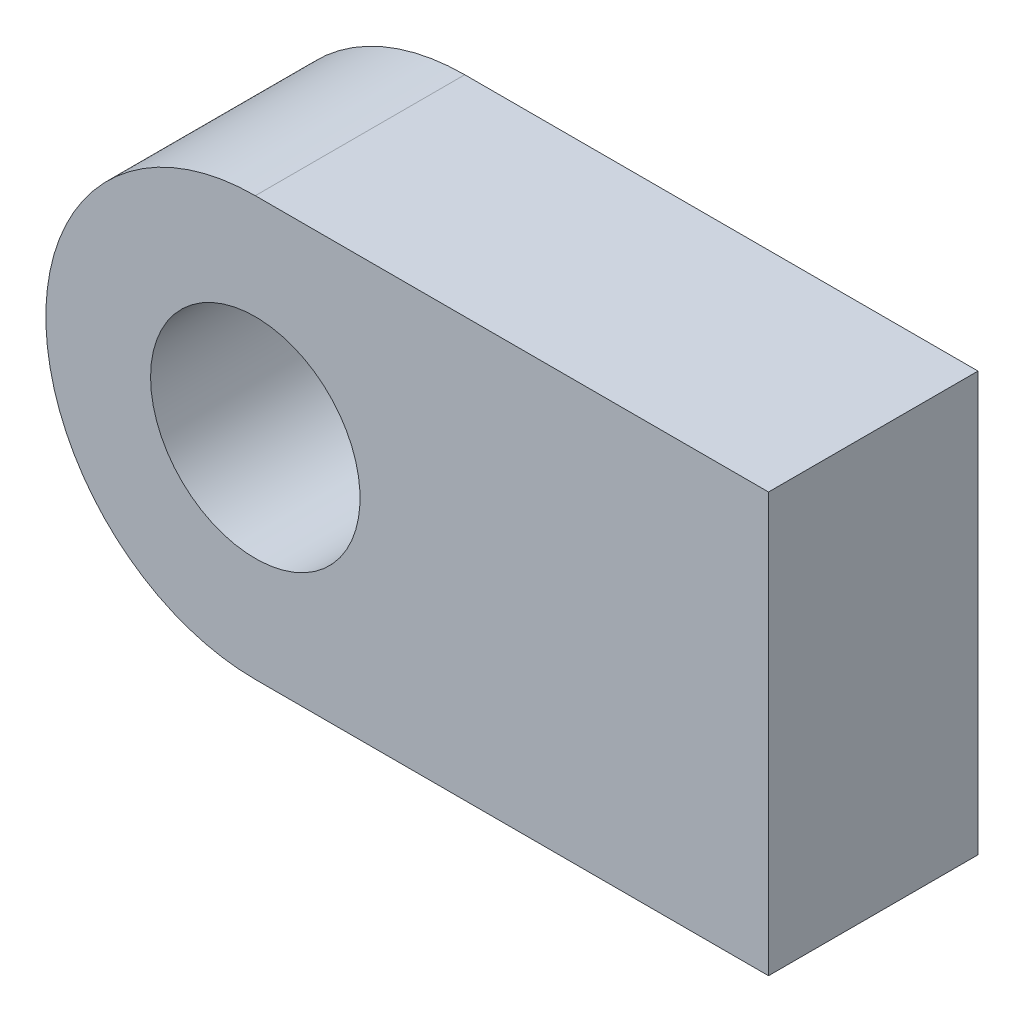
from build123d import *

# Parameters (mm, degrees)
SKETCH7_W           = 34.5
SKETCH7_H           = 10
BOSS_EXTRUDE3_DEPTH = 20
CUT_EXTRUDE9_DEPTH  = 26
SKETCH9_R           = 5
CUT_EXTRUDE10_DEPTH = 26


with BuildPart() as part:
    # Sketch7 → Boss-Extrude3 (new body)
    with BuildSketch(Plane(origin=(0, 0, 0), x_dir=(1, 0, 0), z_dir=(0, 1, 0))):
        with Locations((17.25, 0)):
            Rectangle(SKETCH7_W, SKETCH7_H)
    extrude(amount=BOSS_EXTRUDE3_DEPTH)

    # Sketch8 → Cut-Extrude9 (cut)
    with BuildSketch(Plane(origin=(0, 0, -5), x_dir=(-1, 0, 0), z_dir=(0, 0, -1))):
        with BuildLine():
            Line((-10, 20), (6.269101311, 20))
            Line((6.269101311, 20), (6.269101311, 0))
            Line((6.269101311, 0), (-10, 0))
            ThreePointArc((-10, 0), (0, 10), (-10, 20))
        make_face()
    extrude(amount=-CUT_EXTRUDE9_DEPTH, mode=Mode.SUBTRACT)

    # Sketch9 → Cut-Extrude10 (cut)
    with BuildSketch(Plane(origin=(0, 0, -5), x_dir=(-1, 0, 0), z_dir=(0, 0, -1))):
        with Locations((-10, 10)):
            Circle(SKETCH9_R)
    extrude(amount=-CUT_EXTRUDE10_DEPTH, mode=Mode.SUBTRACT)


solid = part.part
